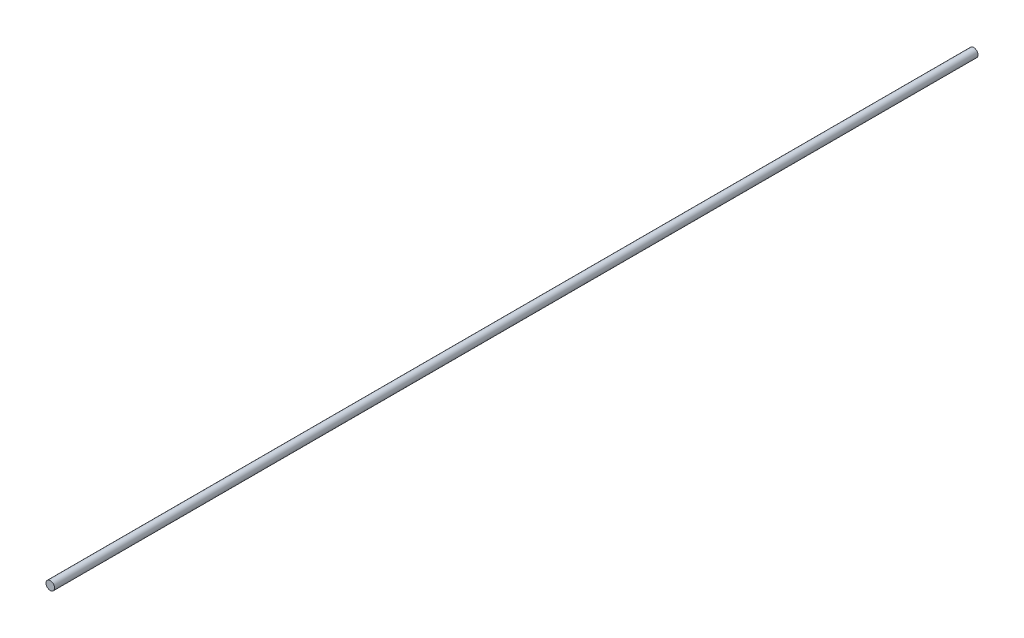
from build123d import *

# Parameters (mm, degrees)
SKETCH1_R = 1.1811
ROD_DEPTH = 254


with BuildPart() as part:
    # Sketch1 → Rod (new body)
    with BuildSketch(Plane.XY):
        Circle(SKETCH1_R)
    extrude(amount=ROD_DEPTH)


solid = part.part
